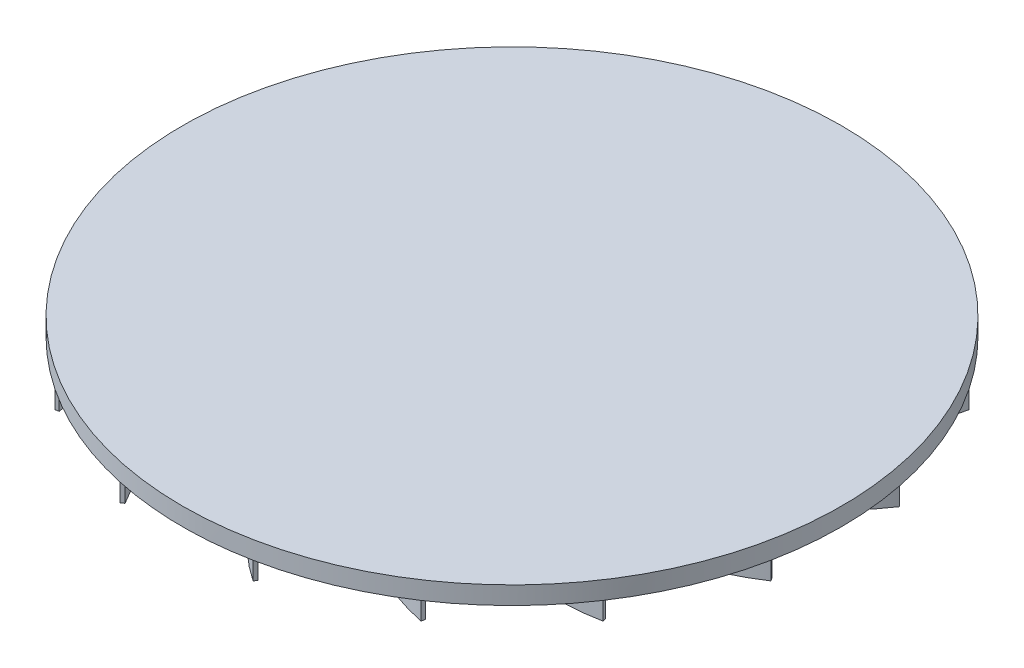
from build123d import *

# Parameters (mm, degrees)
SKETCH1_R            = 233.68
BOSS_EXTRUDE1_DEPTH  = 12.7
EXTRUDE_THIN12_DEPTH = 12.7


with BuildPart() as part:
    # Sketch1 → Boss-Extrude1 (new body)
    with BuildSketch(Plane(origin=(0, 0, 0), x_dir=(1, 0, 0), z_dir=(0, 1, 0))):
        with Locations(Location((0, 0, 0), (0, 0, 270))):
            Circle(SKETCH1_R)
    extrude(amount=BOSS_EXTRUDE1_DEPTH)

    # Sketch7 → Extrude-Thin12 (add)
    with BuildSketch(Plane(origin=(0, 0, 0), x_dir=(-1, 0, 0), z_dir=(0, -1, 0))):
        with BuildLine():
            ThreePointArc((-10.564663134, -7.059082223), (-77.005451954, -106.494749647), (-194.297819003, -129.825652052))
            Line((-194.297819003, -129.825652052), (-193.802289585, -127.33445744))
            ThreePointArc((-193.802289585, -127.33445744), (-78.416600346, -104.382816831), (-13.055857746, -6.563552805))
            Line((-13.055857746, -6.563552805), (-10.564663134, -7.059082223))
        make_face()
        with BuildLine():
            ThreePointArc((10.564663134, 7.059082223), (77.005451954, 106.494749647), (194.297819003, 129.825652052))
            Line((194.297819003, 129.825652052), (193.802289585, 127.33445744))
            ThreePointArc((193.802289585, 127.33445744), (78.416600346, 104.382816831), (13.055857746, 6.563552805))
            Line((13.055857746, 6.563552805), (10.564663134, 7.059082223))
        make_face()
        with BuildLine():
            ThreePointArc((-12.461869852, -2.478820034), (-111.897537276, -68.919608854), (-229.189904325, -45.588706449))
            Line((-229.189904325, -45.588706449), (-227.778755933, -43.476773633))
            ThreePointArc((-227.778755933, -43.476773633), (-112.393066694, -66.428414242), (-14.573802667, -1.067671642))
            Line((-14.573802667, -1.067671642), (-12.461869852, -2.478820034))
        make_face()
        with BuildLine():
            ThreePointArc((-12.461869852, 2.478820034), (-129.754236901, -20.852082371), (-229.189904325, 45.588706449))
            Line((-229.189904325, 45.588706449), (-227.077971509, 46.999854841))
            ThreePointArc((-227.077971509, 46.999854841), (-129.258707483, -18.360887759), (-13.873018244, 4.590752849))
            Line((-13.873018244, 4.590752849), (-12.461869852, 2.478820034))
        make_face()
        with BuildLine():
            ThreePointArc((12.461869852, -2.478820034), (129.754236901, 20.852082371), (229.189904325, -45.588706449))
            Line((229.189904325, -45.588706449), (227.077971509, -46.999854841))
            ThreePointArc((227.077971509, -46.999854841), (129.258707483, 18.360887759), (13.873018244, -4.590752849))
            Line((13.873018244, -4.590752849), (12.461869852, -2.478820034))
        make_face()
        with BuildLine():
            ThreePointArc((12.461869852, 2.478820034), (111.897537276, 68.919608854), (229.189904325, 45.588706449))
            Line((229.189904325, 45.588706449), (227.778755933, 43.476773633))
            ThreePointArc((227.778755933, 43.476773633), (112.393066694, 66.428414242), (14.573802667, 1.067671642))
            Line((14.573802667, 1.067671642), (12.461869852, 2.478820034))
        make_face()
        with BuildLine():
            ThreePointArc((-7.059082223, -10.564663134), (-30.389984628, -127.857030183), (-129.825652052, -194.297819003))
            Line((-129.825652052, -194.297819003), (-130.32118147, -191.806624391))
            ThreePointArc((-130.32118147, -191.806624391), (-32.501917443, -126.445881791), (-9.550276835, -11.060192552))
            Line((-9.550276835, -11.060192552), (-7.059082223, -10.564663134))
        make_face()
        with BuildLine():
            ThreePointArc((7.059082223, 10.564663134), (30.389984628, 127.857030183), (129.825652052, 194.297819003))
            Line((129.825652052, 194.297819003), (130.32118147, 191.806624391))
            ThreePointArc((130.32118147, 191.806624391), (32.501917443, 126.445881791), (9.550276835, 11.060192552))
            Line((9.550276835, 11.060192552), (7.059082223, 10.564663134))
        make_face()
        with BuildLine():
            ThreePointArc((-2.478820034, 12.461869852), (-68.919608854, 111.897537276), (-45.588706449, 229.189904325))
            Line((-45.588706449, 229.189904325), (-43.476773633, 227.778755933))
            ThreePointArc((-43.476773633, 227.778755933), (-66.428414242, 112.393066694), (-1.067671642, 14.573802667))
            Line((-1.067671642, 14.573802667), (-2.478820034, 12.461869852))
        make_face()
        with BuildLine():
            ThreePointArc((2.695932116, -12.416710474), (70.861993364, -110.677681713), (49.58167843, -228.359364958))
            Line((49.58167843, -228.359364958), (47.445439337, -226.985289801))
            ThreePointArc((47.445439337, -226.985289801), (68.379826353, -111.216613001), (1.321856958, -14.552949567))
            Line((1.321856958, -14.552949567), (2.695932116, -12.416710474))
        make_face()
        with BuildLine():
            ThreePointArc((7.059082223, -10.564663134), (106.494749647, -77.005451954), (129.825652052, -194.297819003))
            Line((129.825652052, -194.297819003), (127.33445744, -193.802289585))
            ThreePointArc((127.33445744, -193.802289585), (104.382816831, -78.416600346), (6.563552805, -13.055857746))
            Line((6.563552805, -13.055857746), (7.059082223, -10.564663134))
        make_face()
        with BuildLine():
            ThreePointArc((-2.478820034, -12.461869852), (20.852082371, -129.754236901), (-45.588706449, -229.189904325))
            Line((-45.588706449, -229.189904325), (-46.999854841, -227.077971509))
            ThreePointArc((-46.999854841, -227.077971509), (18.360887759, -129.258707483), (-4.590752849, -13.873018244))
            Line((-4.590752849, -13.873018244), (-2.478820034, -12.461869852))
        make_face()
        with BuildLine():
            ThreePointArc((2.695932116, 12.416710474), (-20.635163502, 129.710048867), (45.80617554, 229.146539757))
            Line((45.80617554, 229.146539757), (47.217323932, 227.034606941))
            ThreePointArc((47.217323932, 227.034606941), (-18.14396889, 129.214519449), (4.807864931, 13.827858866))
            Line((4.807864931, 13.827858866), (2.695932116, 12.416710474))
        make_face()
        with BuildLine():
            ThreePointArc((10.564663134, -7.059082223), (127.857030183, -30.389984628), (194.297819003, -129.825652052))
            Line((194.297819003, -129.825652052), (191.806624391, -130.32118147))
            ThreePointArc((191.806624391, -130.32118147), (126.445881791, -32.501917443), (11.060192552, -9.550276835))
            Line((11.060192552, -9.550276835), (10.564663134, -7.059082223))
        make_face()
        with BuildLine():
            ThreePointArc((-7.059082223, 10.564663134), (-106.494749647, 77.005451954), (-129.825652052, 194.297819003))
            Line((-129.825652052, 194.297819003), (-127.33445744, 193.802289585))
            ThreePointArc((-127.33445744, 193.802289585), (-104.382816831, 78.416600346), (-6.563552805, 13.055857746))
            Line((-6.563552805, 13.055857746), (-7.059082223, 10.564663134))
        make_face()
        with BuildLine():
            ThreePointArc((-10.564663134, 7.059082223), (-127.857030183, 30.389984628), (-194.297819003, 129.825652052))
            Line((-194.297819003, 129.825652052), (-191.806624391, 130.32118147))
            ThreePointArc((-191.806624391, 130.32118147), (-126.445881791, 32.501917443), (-11.060192552, 9.550276835))
            Line((-11.060192552, 9.550276835), (-10.564663134, 7.059082223))
        make_face()
    extrude(amount=EXTRUDE_THIN12_DEPTH)


solid = part.part
